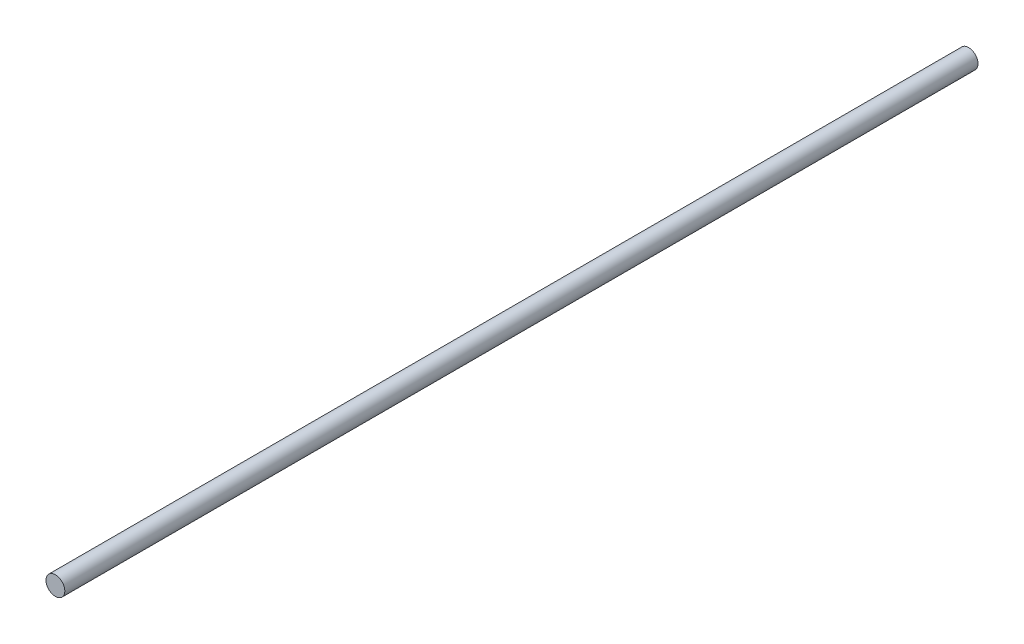
from build123d import *

# Parameters (mm, degrees)
SKETCH1_R           = 1
BOSS_EXTRUDE1_DEPTH = 97


with BuildPart() as part:
    # Sketch1 → Boss-Extrude1 (new body)
    with BuildSketch(Plane.XY):
        with Locations((20, 0)):
            Circle(SKETCH1_R)
    extrude(amount=-BOSS_EXTRUDE1_DEPTH)


solid = part.part
